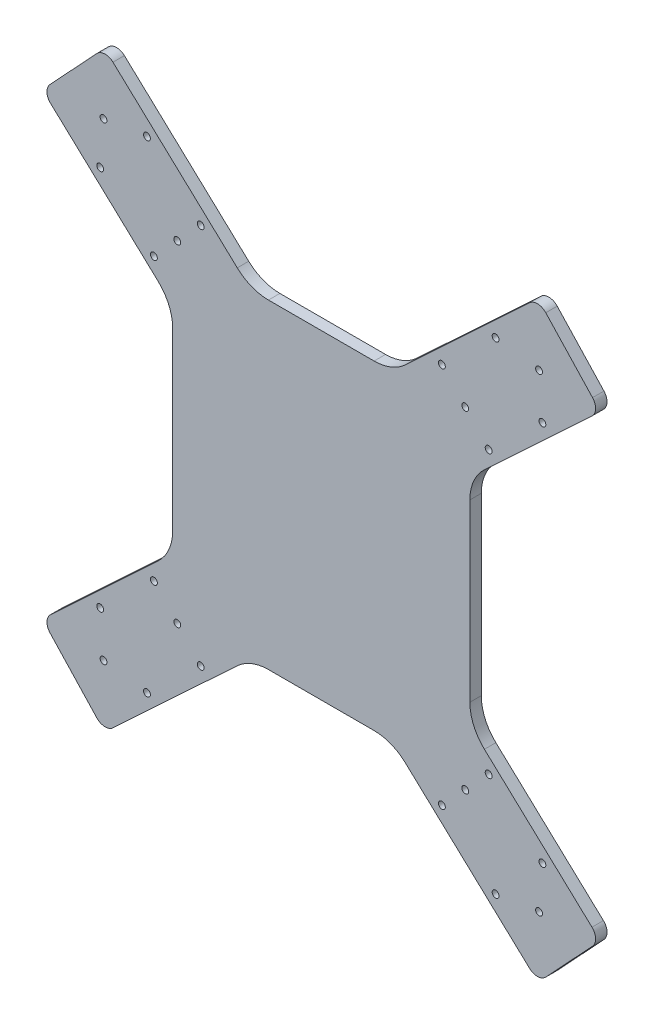
from build123d import *

# Parameters (mm, degrees)
EXTRUDE_1_DEPTH     = 5
SKETCH_3_R          = 1.5
CUT_EXTRUDE_1_DEPTH = 10
SKETCH_4_R          = 1.5
CUT_EXTRUDE_2_DEPTH = 10
SKETCH_5_R          = 1.5
CUT_EXTRUDE_3_DEPTH = 33


with BuildPart() as part:
    # 草图2 → 凸台-拉伸1 (new body)
    with BuildSketch(Plane.XY):
        with BuildLine():
            Line((2769.066394733, 1854.135920645), (2815.285788336, 1854.135920645))
            ThreePointArc((2815.285788336, 1854.135920645), (2822.615812871, 1855.527569285), (2828.925755538, 1859.508846613))
            Line((2828.925755538, 1859.508846613), (2883.306876366, 1910.220062186))
            ThreePointArc((2883.306876366, 1910.220062186), (2886.89136565, 1911.560247813), (2890.373636674, 1909.973285478))
            Line((2890.373636674, 1909.973285478), (2910.833587476, 1888.03267443))
            ThreePointArc((2910.833587476, 1888.03267443), (2912.173773103, 1884.448185146), (2910.586810768, 1880.965914121))
            Line((2910.586810768, 1880.965914121), (2863.536124333, 1837.090439207))
            ThreePointArc((2863.536124333, 1837.090439207), (2858.834890047, 1830.438346554), (2857.176091534, 1822.463365175))
            Line((2857.176091534, 1822.463365175), (2857.176091534, 1745.808476115))
            ThreePointArc((2857.176091534, 1745.808476115), (2858.834890047, 1737.833494737), (2863.536124333, 1731.181402083))
            Line((2863.536124333, 1731.181402083), (2910.586810768, 1687.305927169))
            ThreePointArc((2910.586810768, 1687.305927169), (2912.173773103, 1683.823656144), (2910.833587476, 1680.239166861))
            Line((2910.833587476, 1680.239166861), (2890.373636674, 1658.298555812))
            ThreePointArc((2890.373636674, 1658.298555812), (2886.89136565, 1656.711593477), (2883.306876366, 1658.051779104))
            Line((2883.306876366, 1658.051779104), (2828.925755538, 1708.762994677))
            ThreePointArc((2828.925755538, 1708.762994677), (2822.615812871, 1712.744272005), (2815.285788336, 1714.135920645))
            Line((2815.285788336, 1714.135920645), (2769.066394733, 1714.135920645))
            ThreePointArc((2769.066394733, 1714.135920645), (2761.736370198, 1712.744272005), (2755.426427531, 1708.762994677))
            Line((2755.426427531, 1708.762994677), (2701.045306703, 1658.051779104))
            ThreePointArc((2701.045306703, 1658.051779104), (2697.460817419, 1656.711593477), (2693.978546395, 1658.298555812))
            Line((2693.978546395, 1658.298555812), (2673.518595593, 1680.239166861))
            ThreePointArc((2673.518595593, 1680.239166861), (2672.178409966, 1683.823656144), (2673.765372301, 1687.305927169))
            Line((2673.765372301, 1687.305927169), (2720.816058736, 1731.181402083))
            ThreePointArc((2720.816058736, 1731.181402083), (2725.517293022, 1737.833494737), (2727.176091534, 1745.808476115))
            Line((2727.176091534, 1745.808476115), (2727.176091534, 1822.463365175))
            ThreePointArc((2727.176091534, 1822.463365175), (2725.517293022, 1830.438346554), (2720.816058736, 1837.090439207))
            Line((2720.816058736, 1837.090439207), (2673.765372301, 1880.965914121))
            ThreePointArc((2673.765372301, 1880.965914121), (2672.178409966, 1884.448185146), (2673.518595593, 1888.03267443))
            Line((2673.518595593, 1888.03267443), (2693.978546395, 1909.973285478))
            ThreePointArc((2693.978546395, 1909.973285478), (2697.460817419, 1911.560247813), (2701.045306703, 1910.220062186))
            Line((2701.045306703, 1910.220062186), (2755.426427531, 1859.508846613))
            ThreePointArc((2755.426427531, 1859.508846613), (2761.736370198, 1855.527569285), (2769.066394733, 1854.135920645))
        make_face()
    extrude(amount=EXTRUDE_1_DEPTH)

    # 草图3 → 切除-拉伸1 (cut)
    with BuildSketch(Plane(origin=(0, 0, 0), x_dir=(-1, 0, 0), z_dir=(0, 0, -1))):
        with Locations((-2868.433025626, 1678.758506614)):
            Circle(SKETCH_3_R)
        with Locations((-2888.892976427, 1700.699117662)):
            Circle(SKETCH_3_R)
        with Locations(Location((-2888.892976427, 1867.572723628, 0), (0, 0, 180))):
            Circle(SKETCH_3_R)
        with Locations((-2868.433025626, 1889.513334676)):
            Circle(SKETCH_3_R)
        with Locations((-2695.459206642, 1867.572723628)):
            Circle(SKETCH_3_R)
        with Locations(Location((-2715.919157443, 1889.513334676, 0), (0, 0, 180))):
            Circle(SKETCH_3_R)
        with Locations((-2715.919157443, 1678.758506614)):
            Circle(SKETCH_3_R)
        with Locations(Location((-2695.459206642, 1700.699117662, 0), (0, 0, 180))):
            Circle(SKETCH_3_R)
    extrude(amount=-CUT_EXTRUDE_1_DEPTH, mode=Mode.SUBTRACT)

    # 草图4 → 切除-拉伸2 (cut)
    with BuildSketch(Plane(origin=(0, 0, 0), x_dir=(-1, 0, 0), z_dir=(0, 0, -1))):
        with Locations((-2887.439245446, 1886.727009473)):
            Circle(SKETCH_4_R)
        with Locations(Location((-2696.912937623, 1886.727009473, 0), (0, 0, 180))):
            Circle(SKETCH_4_R)
        with Locations((-2696.912937623, 1681.544831817)):
            Circle(SKETCH_4_R)
        with Locations(Location((-2887.439245446, 1681.544831817, 0), (0, 0, 180))):
            Circle(SKETCH_4_R)
    extrude(amount=-CUT_EXTRUDE_2_DEPTH, mode=Mode.SUBTRACT)

    # 草图5 → 切除-拉伸3 (cut)
    with BuildSketch(Plane(origin=(0, 0, 0), x_dir=(-1, 0, 0), z_dir=(0, 0, -1))):
        with Locations((-2739.420254686, 1700.673634334)):
            Circle(SKETCH_5_R)
        with Locations(Location((-2718.960303884, 1722.614245382, 0), (0, 0, 180))):
            Circle(SKETCH_5_R)
        with Locations((-2729.190279285, 1711.643939858)):
            Circle(SKETCH_5_R)
        with Locations(Location((-2729.190279285, 1856.627901432, 0), (0, 0, 180))):
            Circle(SKETCH_5_R)
        with Locations((-2718.960303884, 1845.657595908)):
            Circle(SKETCH_5_R)
        with Locations(Location((-2739.420254686, 1867.598206957, 0), (0, 0, 180))):
            Circle(SKETCH_5_R)
        with Locations((-2844.931928383, 1867.598206957)):
            Circle(SKETCH_5_R)
        with Locations(Location((-2865.391879185, 1845.657595908, 0), (0, 0, 180))):
            Circle(SKETCH_5_R)
        with Locations((-2855.161903784, 1856.627901432)):
            Circle(SKETCH_5_R)
        with Locations(Location((-2855.161903784, 1711.643939858, 0), (0, 0, 180))):
            Circle(SKETCH_5_R)
        with Locations((-2865.391879185, 1722.614245382)):
            Circle(SKETCH_5_R)
        with Locations(Location((-2844.931928383, 1700.673634334, 0), (0, 0, 180))):
            Circle(SKETCH_5_R)
    extrude(amount=-CUT_EXTRUDE_3_DEPTH, mode=Mode.SUBTRACT)


solid = part.part
